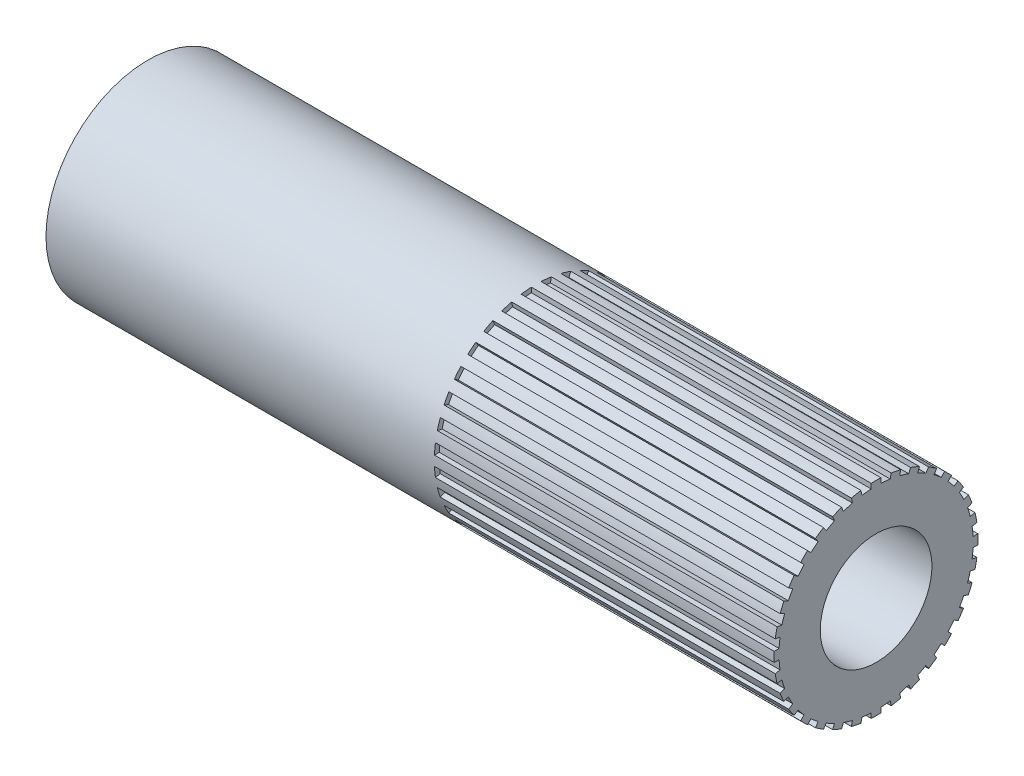
from build123d import *
from build123d.topology import SkipClean

# Parameters (mm, degrees)
SKETCH1_W                = 155
SKETCH1_H                = 16
CUT_EXTRUDE1_DEPTH       = 81.735679845
CUT_EXTRUDE1_DEPTH_BACK  = 81.735679845
SKETCH2_R                = 6.25
SKETCH4_W                = 50
SKETCH4_H                = 7
CUT_EXTRUDE3_DEPTH       = 38
BOSS_EXTRUDE1_DEPTH      = 5
SKETCH24_R               = 12
CUT_EXTRUDE12_DEPTH      = 20
SKETCH12_R               = 16
SKETCH12_R_2             = 10
CUT_EXTRUDE6_DEPTH       = 35
SKETCH13_R               = 6
BOSS_EXTRUDE2_DEPTH      = 15
CHAMFER2_SIZE            = 0.5
SKETCH17_R               = 16
SKETCH17_R_2             = 12.5
CUT_EXTRUDE9_DEPTH       = 75
SKETCH14_W               = 1
SKETCH14_H               = 1
BOSS_EXTRUDE3_DEPTH      = 35
CIRPATTERN1_COUNT        = 32
SKETCH25_R               = 5.75
CUT_EXTRUDE13_DEPTH      = 177.456793597
CUT_EXTRUDE14_DEPTH      = 95.984538346
CUT_EXTRUDE14_DEPTH_BACK = 95.984538346
SKETCH26_W               = 19.801665382
SKETCH26_H               = 22.360111914
SKETCH26_W_2             = 74.343187372
SKETCH26_H_2             = 46.395994085
CUT_EXTRUDE16_DEPTH      = 63.813829491
CUT_EXTRUDE16_DEPTH_BACK = 63.813829491
SKETCH27_OUTSIDE_W       = 47.324
SKETCH27_OUTSIDE_H       = 47.324
SKETCH27_OUTSIDE_R       = 10.500000347
CUT_EXTRUDE17_DEPTH      = 79.909758678
CUT_EXTRUDE17_DEPTH_BACK = 79.909758678
SKETCH28_OUTSIDE_W       = 117.235
SKETCH28_OUTSIDE_H       = 42.96
SKETCH28_OUTSIDE_W_2     = 75
SKETCH28_OUTSIDE_H_2     = 21.000000694


with BuildPart() as part:
    # Sketch1 → Revolve1 (revolve)
    with BuildSketch(Plane(origin=(0, 0, 0), x_dir=(1, 0, 0), z_dir=(0, 1, 0))):
        with Locations((0, -8)):
            Rectangle(SKETCH1_W, SKETCH1_H)
    revolve(axis=Axis((-77.5, 0, 0), (1, 0, 0)))

    # Sketch2 → Cut-Extrude1 (cut, two sides: drawn at the far end of the back side and taken through both)
    with BuildSketch(Plane(origin=(0, 0, 0), x_dir=(1, 0, 0), z_dir=(0, 1, 0)).offset(-CUT_EXTRUDE1_DEPTH_BACK)):
        with Locations(Location((-53.5, 0, 0), (0, 0, 270))):
            Circle(SKETCH2_R)
    extrude(amount=CUT_EXTRUDE1_DEPTH + CUT_EXTRUDE1_DEPTH_BACK, mode=Mode.SUBTRACT)

    # Sketch4 → Cut-Extrude3 (cut)
    with BuildSketch(Plane.ZY.offset(77.5)):
        Rectangle(SKETCH4_W, SKETCH4_H)
    extrude(amount=-CUT_EXTRUDE3_DEPTH, mode=Mode.SUBTRACT)

    # Sketch6 → Boss-Extrude1 (add)
    with BuildSketch(Plane.ZY.offset(77.5)):
        with BuildLine():
            Line((-15.612494996, 3.5), (15.612494996, 3.5))
            ThreePointArc((15.612494996, 3.5), (0, 16), (-15.612494996, 3.5))
        make_face()
        with BuildLine():
            Line((15.612494996, -3.5), (-15.612494996, -3.5))
            ThreePointArc((-15.612494996, -3.5), (0, -16), (15.612494996, -3.5))
        make_face()
    extrude(amount=BOSS_EXTRUDE1_DEPTH)

    # Sketch24 → Cut-Extrude12 (cut)
    with BuildSketch(Plane.ZY.offset(82.5)):
        Circle(SKETCH24_R)
    extrude(amount=-CUT_EXTRUDE12_DEPTH, mode=Mode.SUBTRACT)

    # Sketch12 → Cut-Extrude6 (cut)
    with BuildSketch(Plane(origin=(77.5, 0, 0), x_dir=(0, 0, -1), z_dir=(1, 0, 0))):
        with Locations(Location((0, 0, 0), (0, 0, 167.364374907))):
            Circle(SKETCH12_R)
        Circle(SKETCH12_R_2, mode=Mode.SUBTRACT)
    extrude(amount=-CUT_EXTRUDE6_DEPTH, mode=Mode.SUBTRACT)

    # Sketch13 → Boss-Extrude2 (add)
    with BuildSketch(Plane(origin=(77.5, 0, 0), x_dir=(0, 0, -1), z_dir=(1, 0, 0))):
        Circle(SKETCH13_R)
    extrude(amount=BOSS_EXTRUDE2_DEPTH)

    # Chamfer2
    chamfer2_edges = [part.edges().sort_by_distance(p)[0] for p in [
        (92.5, 0, 6),
    ]]
    chamfer(chamfer2_edges, length=CHAMFER2_SIZE)

    # Sketch17 → Cut-Extrude9 (cut)
    with BuildSketch(Plane(origin=(47.5, 0, 0), x_dir=(0, 0, -1), z_dir=(1, 0, 0))):
        with Locations(Location((0, 0, 0), (0, 0, 167.364374907))):
            Circle(SKETCH17_R)
        Circle(SKETCH17_R_2, mode=Mode.SUBTRACT)
    extrude(amount=-CUT_EXTRUDE9_DEPTH, mode=Mode.SUBTRACT)

    # Sketch14 → Boss-Extrude3 (add)
    with SkipClean():  # the faces are left unmerged after this step: merging them gives an invalid solid
        with BuildSketch(Plane(origin=(77.5, 0, 0), x_dir=(0, 0, -1), z_dir=(1, 0, 0))):
            with Locations((0, 10)):
                Rectangle(SKETCH14_W, SKETCH14_H)
        boss_extrude3 = extrude(amount=-BOSS_EXTRUDE3_DEPTH)

    # CirPattern1: Boss-Extrude3 ×32 about axis
    with SkipClean():  # the faces are left unmerged after this step: merging them gives an invalid solid
        cirpattern1_axis = Axis((0, 0, 0), (1, 0, 0))
        for i in range(1, CIRPATTERN1_COUNT):
            add(boss_extrude3.rotate(cirpattern1_axis, i * 360 / CIRPATTERN1_COUNT))

    # Sketch25 → Cut-Extrude13 (cut, through all)
    with SkipClean():  # the faces are left unmerged after this step: merging them gives an invalid solid
        with BuildSketch(Plane(origin=(92.5, 0, 0), x_dir=(0, 0, -1), z_dir=(1, 0, 0))):
            with Locations(Location((0, 0, 0), (0, 0, 37.495249765))):
                Circle(SKETCH25_R)
        extrude(amount=-CUT_EXTRUDE13_DEPTH, mode=Mode.SUBTRACT)

    # Sketch26 → Cut-Extrude14 (cut, two sides: drawn at the far end of the back side and taken through both)
    with BuildSketch(Plane(origin=(0, 0, 0), x_dir=(1, 0, 0), z_dir=(0, 1, 0)).offset(-CUT_EXTRUDE14_DEPTH_BACK)):
        with Locations((87.400832691, -0.784265352)):
            Rectangle(SKETCH26_W, SKETCH26_H)
        with Locations((-54.946606546, -0.456653486)):
            Rectangle(SKETCH26_W_2, SKETCH26_H_2)
    extrude(amount=CUT_EXTRUDE14_DEPTH + CUT_EXTRUDE14_DEPTH_BACK, mode=Mode.SUBTRACT)

    # Sketch27 outside → Cut-Extrude16 (cut, two sides: drawn at the far end of the back side and taken through both)
    with BuildSketch(Plane(origin=(42.5, 0, 0), x_dir=(0, 0, -1), z_dir=(1, 0, 0)).offset(-CUT_EXTRUDE16_DEPTH_BACK)):
        Rectangle(SKETCH27_OUTSIDE_W, SKETCH27_OUTSIDE_H)
        Circle(SKETCH27_OUTSIDE_R, mode=Mode.SUBTRACT)
    extrude(amount=CUT_EXTRUDE16_DEPTH + CUT_EXTRUDE16_DEPTH_BACK, mode=Mode.SUBTRACT)

    # Sketch28 outside → Cut-Extrude17 (cut, two sides: drawn at the far end of the back side and taken through both)
    with BuildSketch(Plane(origin=(0, 0, 0), x_dir=(1, 0, 0), z_dir=(0, 1, 0)).offset(-CUT_EXTRUDE17_DEPTH_BACK)):
        with Locations((29.8625, 0)):
            Rectangle(SKETCH28_OUTSIDE_W, SKETCH28_OUTSIDE_H)
        with Locations((40, 0)):
            Rectangle(SKETCH28_OUTSIDE_W_2, SKETCH28_OUTSIDE_H_2, mode=Mode.SUBTRACT)
    extrude(amount=CUT_EXTRUDE17_DEPTH + CUT_EXTRUDE17_DEPTH_BACK, mode=Mode.SUBTRACT)


solid = part.part
